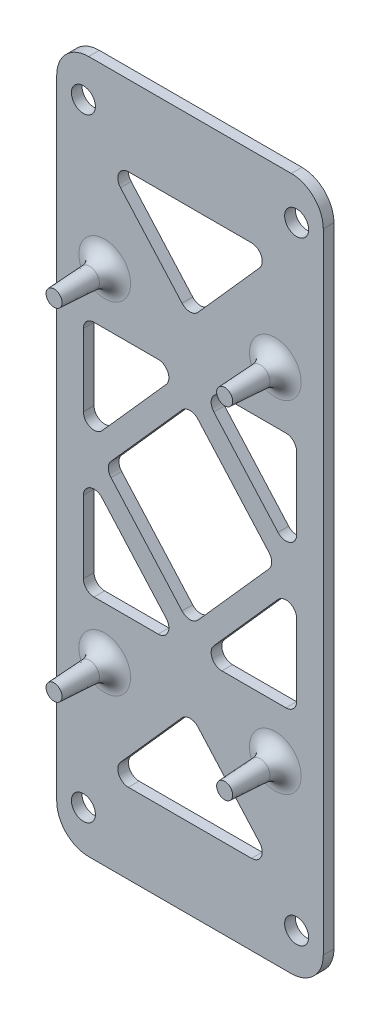
from build123d import *

# Parameters (mm, degrees)
SKETCH_1_R          = 2.25
EXTRUDE_1_DEPTH     = 2
FILLET_1_R          = 6
FILLET_2_R          = 3
CUT_EXTRUDE_1_DEPTH = 2
FILLET_3_R          = 2
CUT_EXTRUDE_2_DEPTH = 2
FILLET_4_R          = 2


with BuildPart() as part:
    # 草图1 → 凸台-拉伸1 (new body)
    # profile 1 of 2: a face of its own
    with BuildSketch(Plane.XY):
        with BuildLine():
            Line((50, 0), (0, 0))
            Line((0, 0), (0, -122.5))
            Line((0, -122.5), (2.75, -122.5))
            ThreePointArc((2.75, -122.5), (5, -120.25), (7.25, -122.5))
            Line((7.25, -122.5), (42.75, -122.5))
            ThreePointArc((42.75, -122.5), (45, -120.25), (47.25, -122.5))
            Line((47.25, -122.5), (50, -122.5))
            Line((50, -122.5), (50, 0))
        make_face()
        with Locations((5, -7.5)):
            Circle(SKETCH_1_R, mode=Mode.SUBTRACT)
        with Locations((45, -7.5)):
            Circle(SKETCH_1_R, mode=Mode.SUBTRACT)
    # profile 2 of 2: a face of its own
    with BuildSketch(Plane.XY):
        with BuildLine():
            Line((2.75, -122.5), (0, -122.5))
            Line((0, -122.5), (0, -130))
            Line((0, -130), (50, -130))
            Line((50, -130), (50, -122.5))
            Line((50, -122.5), (47.25, -122.5))
            ThreePointArc((47.25, -122.5), (45, -124.75), (42.75, -122.5))
            Line((42.75, -122.5), (7.25, -122.5))
            ThreePointArc((7.25, -122.5), (5, -124.75), (2.75, -122.5))
        make_face()
    extrude(amount=EXTRUDE_1_DEPTH)

    # 圆角1
    fillet_1_edges = [part.edges().sort_by_distance(p)[0] for p in [
        (0, 0, 1),
        (50, 0, 1),
        (50, -130, 1),
        (0, -130, 1),
    ]]
    fillet(fillet_1_edges, radius=FILLET_1_R)

    # 草图5 → 旋转1 (revolve)
    with BuildSketch(Plane(origin=(0, -33, 0), x_dir=(1, 0, 0), z_dir=(0, 1, 0))):
        Polygon((9, -2), (7, -2), (7.5, -11.5), (9, -11.5), align=None)
    revolve_1 = revolve(axis=Axis((9, -33, 2), (0, 0, 1)))

    # 镜向1: 旋转1 across plane
    add(revolve_1.mirror(Plane.ZY.offset(-25)))

    # 镜向1 at the second plane: 旋转1 across plane
    add(revolve_1.mirror(Plane.ZX.offset(-65)))

    # 镜向1 at the second plane copy 1 sket → 镜向1 at the second plane copy 1 (revolve)
    with BuildSketch(Plane(origin=(50, -97, 0), x_dir=(-1, 0, 0), z_dir=(0, -1, 0))):
        Polygon((9, -2), (7, -2), (7.5, -11.5), (9, -11.5), align=None)
    revolve(axis=Axis((41, -97, 2), (0, 0, 1)))

    # 圆角2
    fillet_2_edges = [part.edges().sort_by_distance(p)[0] for p in [
        (11, -33, 2),
        (11, -97, 2),
        (39, -33, 2),
        (39, -97, 2),
    ]]
    fillet(fillet_2_edges, radius=FILLET_2_R)

    # 草图7 → 切除-拉伸1 (cut)
    with BuildSketch(Plane.XY.offset(2)):
        Polygon((41, -15), (9, -15), (25, -33), align=None)
        Polygon((9, -65), (25, -83), (41, -65), (25, -47), align=None)
        Polygon((25, -97), (9, -115), (41, -115), align=None)
    extrude(amount=-CUT_EXTRUDE_1_DEPTH, mode=Mode.SUBTRACT)

    # 圆角3
    fillet_3_edges = [part.edges().sort_by_distance(p)[0] for p in [
        (25, -33, 1),
        (9, -15, 1),
        (41, -15, 1),
        (25, -83, 1),
        (9, -65, 1),
        (25, -47, 1),
        (41, -65, 1),
        (25, -97, 1),
        (41, -115, 1),
        (9, -115, 1),
    ]]
    fillet(fillet_3_edges, radius=FILLET_3_R)

    # 草图8 → 切除-拉伸2 (cut)
    with BuildSketch(Plane.XY.offset(2)):
        Polygon((5, -42.681670967), (5, -63.479202711), (23.486694883, -42.681670967), align=None)
        Polygon((45, -63.479202711), (26.513305117, -42.681670967), (45, -42.681670967), align=None)
        Polygon((45, -87.318329033), (45, -66.520797289), (26.513305117, -87.318329033), align=None)
        Polygon((5, -87.318329033), (5, -66.520797289), (23.486694883, -87.318329033), align=None)
    extrude(amount=-CUT_EXTRUDE_2_DEPTH, mode=Mode.SUBTRACT)

    # 圆角4
    fillet_4_edges = [part.edges().sort_by_distance(p)[0] for p in [
        (5, -87.318329033, 1),
        (5, -66.520797289, 1),
        (23.486694883, -87.318329033, 1),
        (45, -66.520797289, 1),
        (45, -87.318329033, 1),
        (26.513305117, -87.318329033, 1),
        (45, -63.479202711, 1),
        (26.513305117, -42.681670967, 1),
        (45, -42.681670967, 1),
        (5, -63.479202711, 1),
        (5, -42.681670967, 1),
        (23.486694883, -42.681670967, 1),
    ]]
    fillet(fillet_4_edges, radius=FILLET_4_R)


solid = part.part
